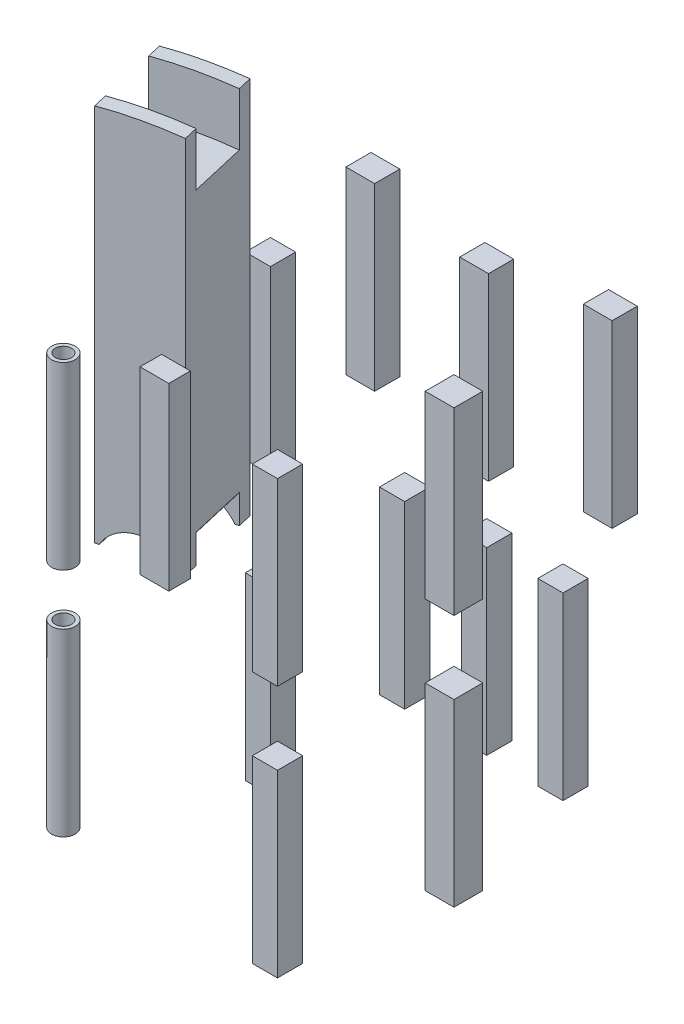
from build123d import *

# Parameters (mm, degrees)
BOSS_EXTRUDE1_START     = 0.1
SKETCH1_W               = 8
SKETCH1_H               = 7
BOSS_EXTRUDE1_DEPTH     = 50
BOSS_EXTRUDE1_2_DEPTH   = 50
BOSS_EXTRUDE2_START     = 0.1
BOSS_EXTRUDE2_DEPTH     = 50
BOSS_EXTRUDE3_START     = 0.1
SKETCH3_W               = 7
SKETCH3_H               = 7
BOSS_EXTRUDE3_DEPTH     = 50
BOSS_EXTRUDE4_START     = 0.1
SKETCH4_W               = 7
SKETCH4_H               = 7
BOSS_EXTRUDE4_DEPTH     = 50
BOSS_EXTRUDE5_START     = 0.1
SKETCH5_W               = 8
SKETCH5_H               = 8
BOSS_EXTRUDE5_DEPTH     = 50
BOSS_EXTRUDE6_START     = 0.1
SKETCH6_W               = 7
SKETCH6_H               = 7
BOSS_EXTRUDE6_DEPTH     = 50
BOSS_EXTRUDE7_START     = 0.1
SKETCH7_W               = 8
SKETCH7_H               = 6
BOSS_EXTRUDE7_DEPTH     = 50
BOSS_EXTRUDE8_START     = 0.1
SKETCH8_R               = 3.275
SKETCH8_R_2             = 2.275
BOSS_EXTRUDE8_DEPTH     = 50
BOSS_EXTRUDE9_START     = 0.1
SKETCH9_W               = 7
SKETCH9_H               = 7
BOSS_EXTRUDE9_DEPTH     = 50
BOSS_EXTRUDE9_2_DEPTH   = 50
BOSS_EXTRUDE9_3_DEPTH   = 50
SKETCH9_W_2             = 8
SKETCH9_H_2             = 8
BOSS_EXTRUDE9_4_DEPTH   = 50
BOSS_EXTRUDE10_START    = 0.1
SKETCH10_W              = 7
SKETCH10_H              = 7
BOSS_EXTRUDE10_DEPTH    = 50
BOSS_EXTRUDE10_2_DEPTH  = 50
BOSS_EXTRUDE11_START    = 0.1
SKETCH11_R              = 3.275
SKETCH11_R_2            = 2.275
BOSS_EXTRUDE11_DEPTH    = 50
SKETCH12_R              = 110.7
SKETCH12_R_2            = 10.7
EXTRUDE_THIN1_DEPTH     = 2
CUT_EXTRUDE1_DEPTH      = 171.917876699
CUT_EXTRUDE1_DEPTH_BACK = 171.917876699
EXTRUDE_THIN2_REACH     = 145.422
SKETCH14_R              = 96
SKETCH14_R_2            = 16
CUT_EXTRUDE2_DEPTH      = 162.371816697
CUT_EXTRUDE2_DEPTH_BACK = 162.371816697
FILLET1_R               = 0.5


with BuildPart() as part:
    # Sketch1 → Boss-Extrude1 (new body)
    with BuildSketch(Plane(origin=(0, 8, 0), x_dir=(1, 0, 0), z_dir=(0, 1, 0)).offset(BOSS_EXTRUDE1_START)):
        with Locations((0, -6)):
            Rectangle(SKETCH1_W, SKETCH1_H)
    extrude(amount=BOSS_EXTRUDE1_DEPTH)


with BuildPart() as body_2:
    # Sketch1 → Boss-Extrude1 2 (new body)
    with BuildSketch(Plane(origin=(0, 8, 0), x_dir=(1, 0, 0), z_dir=(0, 1, 0)).offset(BOSS_EXTRUDE1_START)):
        with Locations((66, -6)):
            Rectangle(SKETCH1_W, SKETCH1_H)
    extrude(amount=BOSS_EXTRUDE1_2_DEPTH)


with BuildPart() as body_3:
    # Sketch2 → Boss-Extrude2 (new body)
    with BuildSketch(Plane(origin=(0, 4, 0), x_dir=(1, 0, 0), z_dir=(0, 1, 0)).offset(BOSS_EXTRUDE2_START)):
        Polygon((37.5, -11.35), (37.5, -4.35), (29.5, -4.35), (29.5, -11.35), (33.75, -11.35), align=None)
    extrude(amount=BOSS_EXTRUDE2_DEPTH)


with BuildPart() as body_4:
    # Sketch3 → Boss-Extrude3 (new body)
    with BuildSketch(Plane(origin=(0, 9, 0), x_dir=(1, 0, 0), z_dir=(0, 1, 0)).offset(BOSS_EXTRUDE3_START)):
        with Locations((-6.25, -48.45)):
            Rectangle(SKETCH3_W, SKETCH3_H)
    extrude(amount=BOSS_EXTRUDE3_DEPTH)


with BuildPart() as body_5:
    # Sketch4 → Boss-Extrude4 (new body)
    with BuildSketch(Plane(origin=(0, 16, 0), x_dir=(1, 0, 0), z_dir=(0, 1, 0)).offset(BOSS_EXTRUDE4_START)):
        with Locations((14, -48.45)):
            Rectangle(SKETCH4_W, SKETCH4_H)
    extrude(amount=BOSS_EXTRUDE4_DEPTH)


with BuildPart() as body_6:
    # Sketch5 → Boss-Extrude5 (new body)
    with BuildSketch(Plane(origin=(0, 8, 0), x_dir=(1, 0, 0), z_dir=(0, 1, 0)).offset(BOSS_EXTRUDE5_START)):
        with Locations((65, -48.45)):
            Rectangle(SKETCH5_W, SKETCH5_H)
    extrude(amount=BOSS_EXTRUDE5_DEPTH)


with BuildPart() as body_7:
    # Sketch6 → Boss-Extrude6 (new body)
    with BuildSketch(Plane(origin=(0, 9, 0), x_dir=(1, 0, 0), z_dir=(0, 1, 0)).offset(BOSS_EXTRUDE6_START)):
        with Locations((59, -91.5)):
            Rectangle(SKETCH6_W, SKETCH6_H)
    extrude(amount=BOSS_EXTRUDE6_DEPTH)


with BuildPart() as body_8:
    # Sketch7 → Boss-Extrude7 (new body)
    with BuildSketch(Plane(origin=(0, 20, 0), x_dir=(1, 0, 0), z_dir=(0, 1, 0)).offset(BOSS_EXTRUDE7_START)):
        with Locations((31.5, -95.2)):
            Rectangle(SKETCH7_W, SKETCH7_H)
    extrude(amount=BOSS_EXTRUDE7_DEPTH)


with BuildPart() as body_9:
    # Sketch8 → Boss-Extrude8 (new body)
    with BuildSketch(Plane(origin=(0, 6, 0), x_dir=(1, 0, 0), z_dir=(0, 1, 0)).offset(BOSS_EXTRUDE8_START)):
        with Locations(Location((-0.5, -91.5, 0), (0, 0, 270))):
            Circle(SKETCH8_R)
        with Locations(Location((-0.5, -91.5, 0), (0, 0, 270))):
            Circle(SKETCH8_R_2, mode=Mode.SUBTRACT)
    extrude(amount=BOSS_EXTRUDE8_DEPTH)


with BuildPart() as body_10:
    # Sketch9 → Boss-Extrude9 (new body)
    with BuildSketch(Plane.XZ.offset(12).offset(BOSS_EXTRUDE9_START)):
        with Locations((11, 8.15)):
            Rectangle(SKETCH9_W, SKETCH9_H)
    extrude(amount=BOSS_EXTRUDE9_DEPTH)


with BuildPart() as body_11:
    # Sketch9 → Boss-Extrude9 2 (new body)
    with BuildSketch(Plane.XZ.offset(12).offset(BOSS_EXTRUDE9_START)):
        with Locations((33.5, 7.85)):
            Rectangle(SKETCH9_W, SKETCH9_H)
    extrude(amount=BOSS_EXTRUDE9_2_DEPTH)


with BuildPart() as body_12:
    # Sketch9 → Boss-Extrude9 3 (new body)
    with BuildSketch(Plane.XZ.offset(12).offset(BOSS_EXTRUDE9_START)):
        with Locations((55, 8.15)):
            Rectangle(SKETCH9_W, SKETCH9_H)
    extrude(amount=BOSS_EXTRUDE9_3_DEPTH)


with BuildPart() as body_13:
    # Sketch9 → Boss-Extrude9 4 (new body)
    with BuildSketch(Plane.XZ.offset(12).offset(BOSS_EXTRUDE9_START)):
        with Locations((65, 48.45)):
            Rectangle(SKETCH9_W_2, SKETCH9_H_2)
    extrude(amount=BOSS_EXTRUDE9_4_DEPTH)


with BuildPart() as body_14:
    # Sketch10 → Boss-Extrude10 (new body)
    with BuildSketch(Plane.XZ.offset(11).offset(BOSS_EXTRUDE10_START)):
        with Locations((59, 91.5)):
            Rectangle(SKETCH10_W, SKETCH10_H)
    extrude(amount=BOSS_EXTRUDE10_DEPTH)


with BuildPart() as body_15:
    # Sketch10 → Boss-Extrude10 2 (new body)
    with BuildSketch(Plane.XZ.offset(11).offset(BOSS_EXTRUDE10_START)):
        with Locations((14, 48.45)):
            Rectangle(SKETCH10_W, SKETCH10_H)
    extrude(amount=BOSS_EXTRUDE10_2_DEPTH)


with BuildPart() as body_16:
    # Sketch11 → Boss-Extrude11 (new body)
    with BuildSketch(Plane.XZ.offset(8).offset(BOSS_EXTRUDE11_START)):
        with Locations(Location((-0.5, 91.5, 0), (0, 0, 270))):
            Circle(SKETCH11_R)
        with Locations(Location((-0.5, 91.5, 0), (0, 0, 270))):
            Circle(SKETCH11_R_2, mode=Mode.SUBTRACT)
    extrude(amount=BOSS_EXTRUDE11_DEPTH)


with BuildPart() as body_17:
    # Sketch12 → Extrude-Thin1 (new, symmetric)
    with BuildSketch(Plane(origin=(12.897697924, 0, 55.866067389), x_dir=(0.9743700647852346, 0, -0.224951054343868), z_dir=(0.224951054343868, -1.1551564284111033e-15, 0.9743700647852346))):
        with Locations((-9.370350163, 0)):
            Circle(SKETCH12_R)
        with Locations((-9.370350163, 0)):
            Circle(SKETCH12_R_2, mode=Mode.SUBTRACT)
    extrude(amount=EXTRUDE_THIN1_DEPTH, both=True)

    # Sketch13 → Cut-Extrude1 (cut, two sides: drawn at the far end of the back side and taken through both)
    with BuildSketch(Plane(origin=(13.347600032, 0, 57.814807519), x_dir=(0.9743700647852346, 0, -0.224951054343868), z_dir=(0.224951054343868, -1.1551564284111033e-15, 0.9743700647852346)).offset(-CUT_EXTRUDE1_DEPTH_BACK)):
        with BuildLine():
            Line((0.08956527, 5), (1.129649837, 5))
            Line((1.129649837, 5), (1.129649837, 110.200907437))
            ThreePointArc((1.129649837, 110.200907437), (-9.370350163, -110.7), (-19.870350163, 110.200907437))
            Line((-19.870350163, 110.200907437), (-19.870350163, 5))
            Line((-19.870350163, 5), (-18.830265596, 5))
            ThreePointArc((-18.830265596, 5), (-9.370350163, 10.7), (0.08956527, 5))
        make_face()
    extrude(amount=CUT_EXTRUDE1_DEPTH + CUT_EXTRUDE1_DEPTH_BACK, mode=Mode.SUBTRACT)


with BuildPart() as body_18:
    # Mirror1: mirrored copy
    add(body_17.part.mirror(Plane(origin=(15.147208467, 0, 65.609768037), x_dir=(0.9743700647852344, 0, -0.22495105434386872), z_dir=(0.22495105434386872, 0, 0.9743700647852345))))


with BuildPart() as body_17_1:
    add(body_17.part)

    # Extrude-Thin2: up to this face of the body (flat: up to its plane)
    extrude_thin2_end = Plane(body_17_1.part.faces().sort_by_distance((3.31760712, 59.578942419, 56.025197409))[0])
    # Sketch14 → Extrude-Thin2 (add, up to the picked face)
    with BuildSketch(Plane(origin=(17.846621119, 0, 77.302208815), x_dir=(0.9743700647852342, 0, -0.2249510543438694), z_dir=(0.22495105434386936, 0, 0.9743700647852341)), mode=Mode.PRIVATE) as extrude_thin2_sk1:
        with Locations((-9.370350163, 0)):
            Circle(SKETCH14_R)
        with Locations((-9.370350163, 0)):
            Circle(SKETCH14_R_2, mode=Mode.SUBTRACT)
    extrude_thin2_tool1 = split(extrude(extrude_thin2_sk1.sketch, amount=-EXTRUDE_THIN2_REACH, mode=Mode.PRIVATE), bisect_by=extrude_thin2_end, keep=Keep.BOTH, mode=Mode.PRIVATE)

    add(body_18.part)  # Extrude-Thin2 merges body 18
    add(extrude_thin2_tool1.solids().sort_by(Axis((-82.177396, 0, 100.394573), (-0.22495105434386936, 0, -0.9743700647852341)))[0])

    # Sketch13<3> → Cut-Extrude2 (cut, two sides: drawn at the far end of the back side and taken through both)
    with BuildSketch(Plane(origin=(13.347600032, 0, 57.814807519), x_dir=(0.9743700647852346, 0, -0.224951054343868), z_dir=(0.224951054343868, -1.1551564284111033e-15, 0.9743700647852346)).offset(-CUT_EXTRUDE2_DEPTH_BACK)):
        with BuildLine():
            Line((0.08956527, 5), (1.129649837, 5))
            Line((1.129649837, 5), (1.129649837, 110.200907437))
            ThreePointArc((1.129649837, 110.200907437), (-9.370350163, -110.7), (-19.870350163, 110.200907437))
            Line((-19.870350163, 110.200907437), (-19.870350163, 5))
            Line((-19.870350163, 5), (-18.830265596, 5))
            ThreePointArc((-18.830265596, 5), (-9.370350163, 10.7), (0.08956527, 5))
        make_face()
    extrude(amount=CUT_EXTRUDE2_DEPTH + CUT_EXTRUDE2_DEPTH_BACK, mode=Mode.SUBTRACT)

    # Fillet1
    fillet1_edges = [body_17_1.edges().sort_by_distance(p)[0] for p in [
        (16.247905452, 12.072696468, 65.355652115),
        (-4.213865908, 12.072696468, 70.079624257),
    ]]
    fillet(fillet1_edges, radius=FILLET1_R)


solid = Compound([part.part, body_2.part, body_3.part, body_4.part, body_5.part, body_6.part, body_7.part, body_8.part, body_9.part, body_10.part, body_11.part, body_12.part, body_13.part, body_14.part, body_15.part, body_16.part, body_17_1.part])
